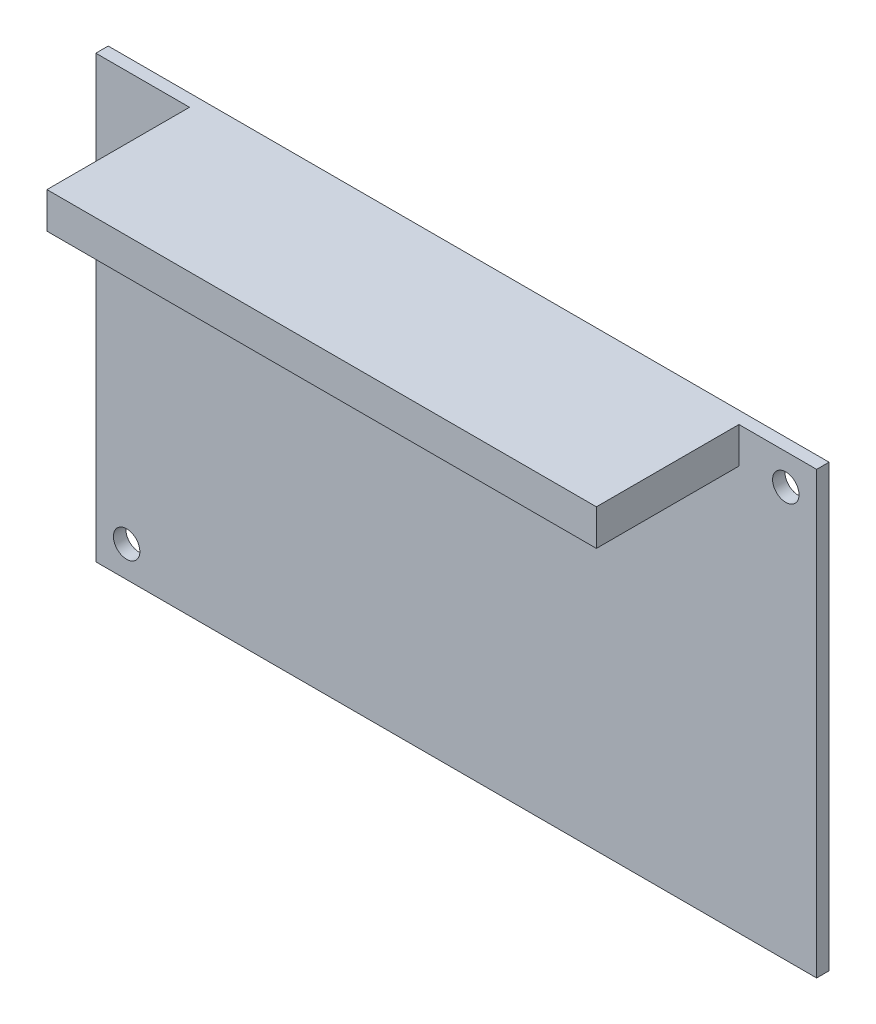
from build123d import *

# Parameters (mm, degrees)
IZIM1_W                     = 90
IZIM1_H                     = 55
IZIM1_R                     = 1.65
Y_KSEKLIK_EKSTR_ZYON1_DEPTH = 1.55
IZIM2_W                     = 68.6
IZIM2_H                     = 4.5
Y_KSEKLIK_EKSTR_ZYON2_DEPTH = 17.8


with BuildPart() as part:
    # Çizim1 → Yükseklik-Ekstrüzyon1 (new body)
    with BuildSketch(Plane.XY):
        with Locations((45, -27.5)):
            Rectangle(IZIM1_W, IZIM1_H)
        with Locations(Location((86.15, -3.85, 0), (0, 0, 180))):
            Circle(IZIM1_R, mode=Mode.SUBTRACT)
        with Locations(Location((3.85, -51.15, 0), (0, 0, 180))):
            Circle(IZIM1_R, mode=Mode.SUBTRACT)
    extrude(amount=Y_KSEKLIK_EKSTR_ZYON1_DEPTH)

    # Çizim2 → Yükseklik-Ekstrüzyon2 (add)
    with BuildSketch(Plane.XY.offset(1.55)):
        with Locations((46, -2.25)):
            Rectangle(IZIM2_W, IZIM2_H)
    extrude(amount=Y_KSEKLIK_EKSTR_ZYON2_DEPTH)


solid = part.part
